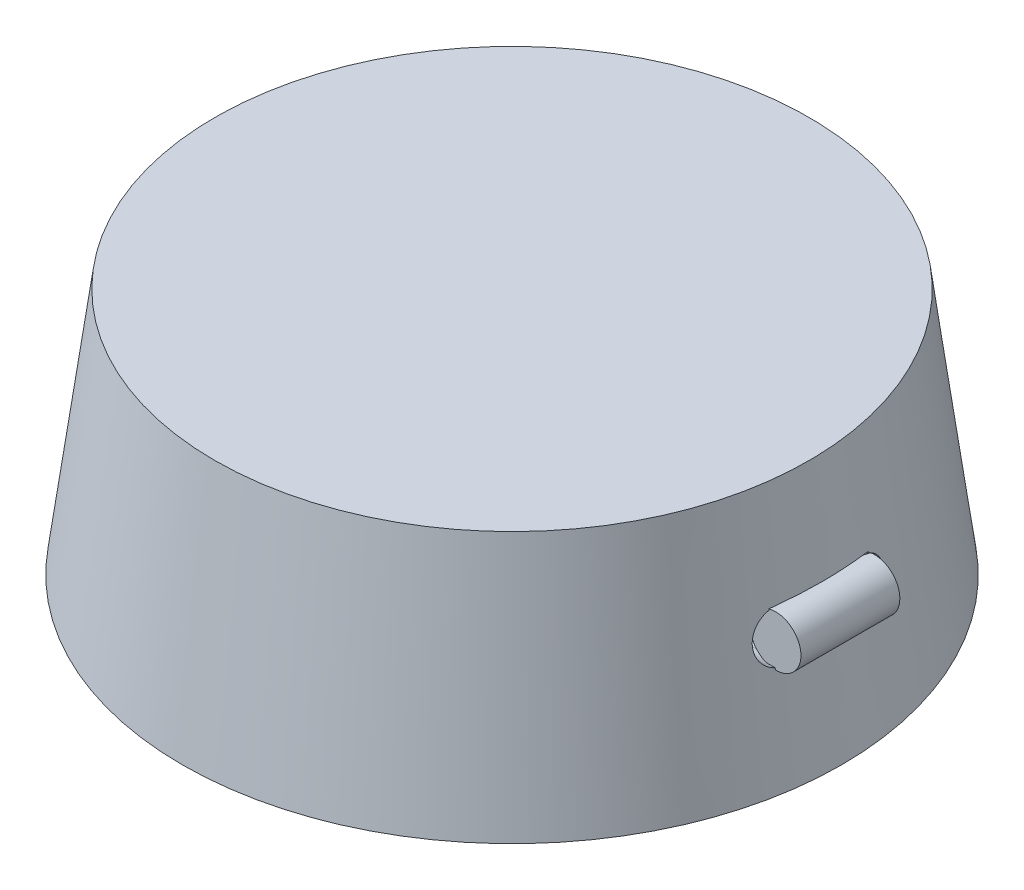
from build123d import *

# Parameters (mm, degrees)
SKETCH1_R               = 100
BOSS_EXTRUDE1_DEPTH     = 75
BOSS_EXTRUDE1_TAPER     = 7.5
CUT_EXTRUDE1_DEPTH      = 125
CUT_EXTRUDE1_DEPTH_BACK = 122
SKETCH3_R               = 7.673209678
BOSS_EXTRUDE5_DEPTH     = 15
SKETCH5_R               = 25
CUT_EXTRUDE3_DEPTH      = 12.5
SKETCH6_R               = 62.5
CUT_EXTRUDE4_DEPTH      = 22.5


with BuildPart() as part:
    # Sketch1 → Boss-Extrude1 (new body)
    with BuildSketch(Plane(origin=(0, 0, 0), x_dir=(1, 0, 0), z_dir=(0, 1, 0))):
        Circle(SKETCH1_R)
    extrude(amount=BOSS_EXTRUDE1_DEPTH, taper=BOSS_EXTRUDE1_TAPER)

    # Sketch2 → Cut-Extrude1 (cut, two sides: drawn at the far end of the back side and taken through both)
    with BuildSketch(Plane(origin=(0, 0, 0), x_dir=(0, 0, -1), z_dir=(1, 0, 0)).offset(-CUT_EXTRUDE1_DEPTH_BACK)):
        with BuildLine():
            Line((-12.527814818, 45), (12.472185182, 45))
            ThreePointArc((12.472185182, 45), (19.972185182, 37.5), (12.472185182, 30))
            Line((12.472185182, 30), (-12.527814818, 30))
            ThreePointArc((-12.527814818, 30), (-20.027814818, 37.5), (-12.527814818, 45))
        make_face()
    extrude(amount=CUT_EXTRUDE1_DEPTH + CUT_EXTRUDE1_DEPTH_BACK, mode=Mode.SUBTRACT)

    # Sketch3 → Boss-Extrude5 (add, symmetric)
    with BuildSketch(Plane.XY):
        with Locations((94.960632329, 37.526119935)):
            Circle(SKETCH3_R)
    boss_extrude5 = extrude(amount=BOSS_EXTRUDE5_DEPTH, both=True)

    # Mirror1: Boss-Extrude5 across plane
    add(boss_extrude5.mirror(Plane(origin=(0, 0, 0), x_dir=(0, 0, 1), z_dir=(1, 0, 0))))

    # Sketch5 → Cut-Extrude3 (cut)
    with BuildSketch(Plane.XZ):
        Circle(SKETCH5_R)
    extrude(amount=-CUT_EXTRUDE3_DEPTH, mode=Mode.SUBTRACT)

    # Sketch6 → Cut-Extrude4 (cut)
    with BuildSketch(Plane(origin=(0, 12.5, 0), x_dir=(1, 0, 0), z_dir=(0, 1, 0))):
        Circle(SKETCH6_R)
    extrude(amount=CUT_EXTRUDE4_DEPTH, mode=Mode.SUBTRACT)


solid = part.part
